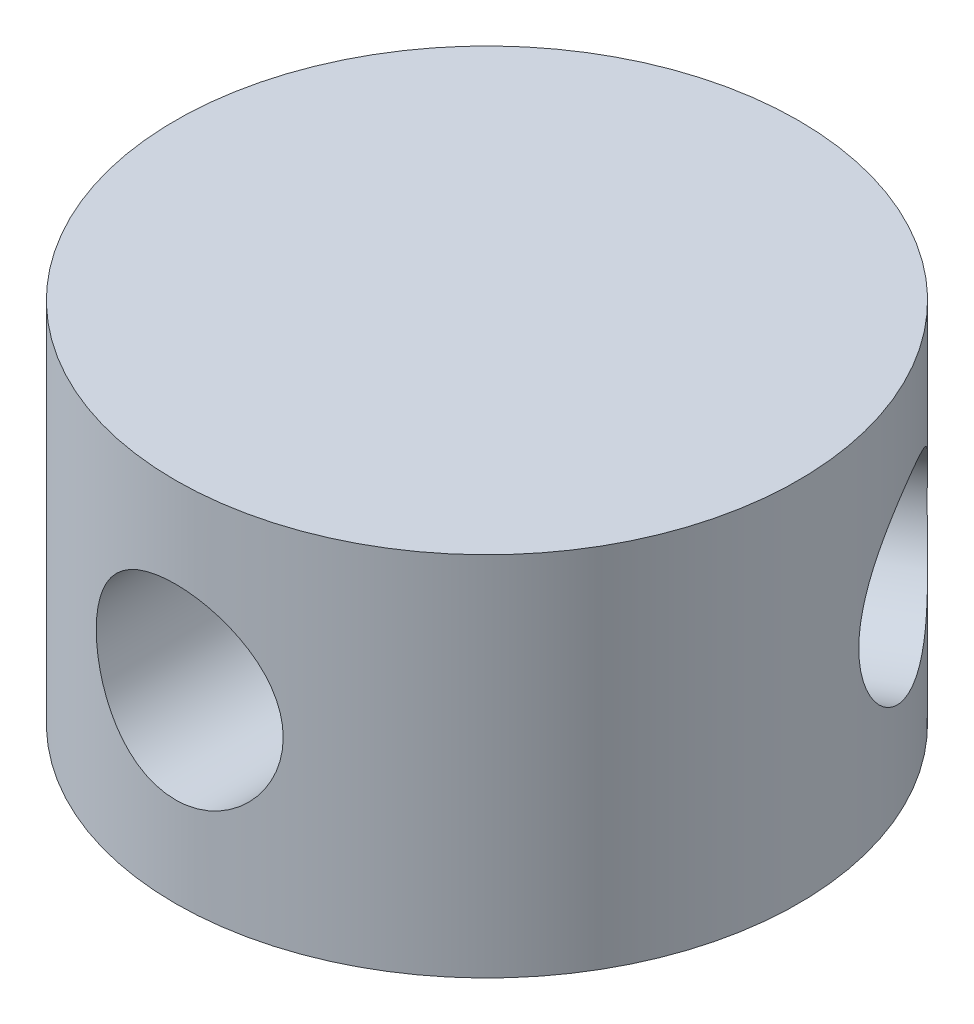
from build123d import *

# Parameters (mm, degrees)
CIRKEL_R                   = 17
CILINDER_DEPTH             = 20
CIRKEL_GAT_R               = 5.1
OPENING_DEPTH              = 10
GATEN_PATROON_COUNT        = 3
CIRKEL1_R                  = 13.5
OPENING_OPZET_DEPTH        = 3
CIRKEL2_R                  = 1.9
GAT_VERLOOPSTUK_DEPTH      = 8
CIRKEL3_R                  = 2.9
GAT_VERLOOPSTUK_RAND_DEPTH = 2


with BuildPart() as part:
    # cirkel → cilinder (new body)
    with BuildSketch(Plane(origin=(0, 0, 0), x_dir=(1, 0, 0), z_dir=(0, 1, 0))):
        with Locations(Location((0, 0, 0), (0, 0, 270))):
            Circle(CIRKEL_R)
    extrude(amount=CILINDER_DEPTH)

    # cirkel_gat → opening (cut)
    with BuildSketch(Plane.XY.offset(17)):
        with Locations((0, 10)):
            Circle(CIRKEL_GAT_R)
    opening = extrude(amount=-OPENING_DEPTH, mode=Mode.SUBTRACT)

    # gaten_patroon: opening ×3 about axis
    gaten_patroon_axis = Axis((0, 0, 0), (0, 1, 0))
    for i in range(1, GATEN_PATROON_COUNT):
        add(opening.rotate(gaten_patroon_axis, i * 360 / GATEN_PATROON_COUNT), mode=Mode.SUBTRACT)

    # cirkel1 → opening_opzet (cut)
    with BuildSketch(Plane(origin=(0, 0, 0), x_dir=(-1, 0, 0), z_dir=(0, -1, 0))):
        with Locations(Location((0, 0, 0), (0, 0, 90))):
            Circle(CIRKEL1_R)
    extrude(amount=-OPENING_OPZET_DEPTH, mode=Mode.SUBTRACT)

    # cirkel2 → gat_verloopstuk (cut)
    with BuildSketch(Plane(origin=(0, 3, 0), x_dir=(-1, 0, 0), z_dir=(0, -1, 0))):
        with Locations(Location((0, 0, 0), (0, 0, 90))):
            Circle(CIRKEL2_R)
    extrude(amount=-GAT_VERLOOPSTUK_DEPTH, mode=Mode.SUBTRACT)

    # cirkel3 → gat_verloopstuk_rand (cut)
    with BuildSketch(Plane.XZ.offset(-3)):
        with Locations(Location((0, 0, 0), (0, 0, 270))):
            Circle(CIRKEL3_R)
    extrude(amount=-GAT_VERLOOPSTUK_RAND_DEPTH, mode=Mode.SUBTRACT)


solid = part.part
